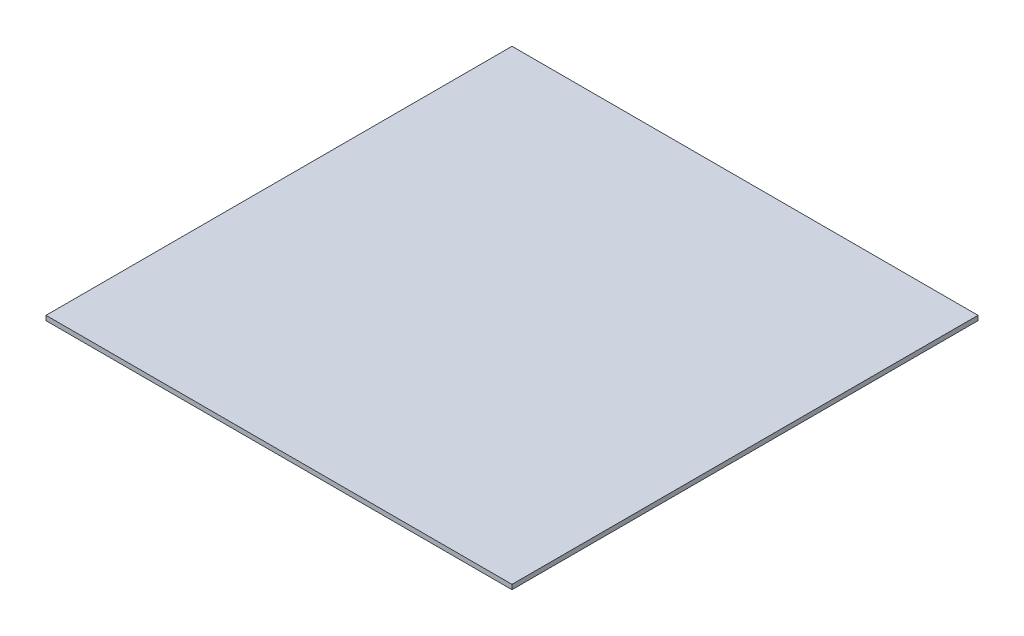
from build123d import *

# Parameters (mm, degrees)
SKETCH1_W           = 2000
SKETCH1_H           = 2000
BOSS_EXTRUDE1_DEPTH = 20


with BuildPart() as part:
    # Sketch1 → Boss-Extrude1 (new body)
    with BuildSketch(Plane(origin=(0, 0, 0), x_dir=(1, 0, 0), z_dir=(0, 1, 0))):
        Rectangle(SKETCH1_W, SKETCH1_H)
    extrude(amount=BOSS_EXTRUDE1_DEPTH)


solid = part.part
